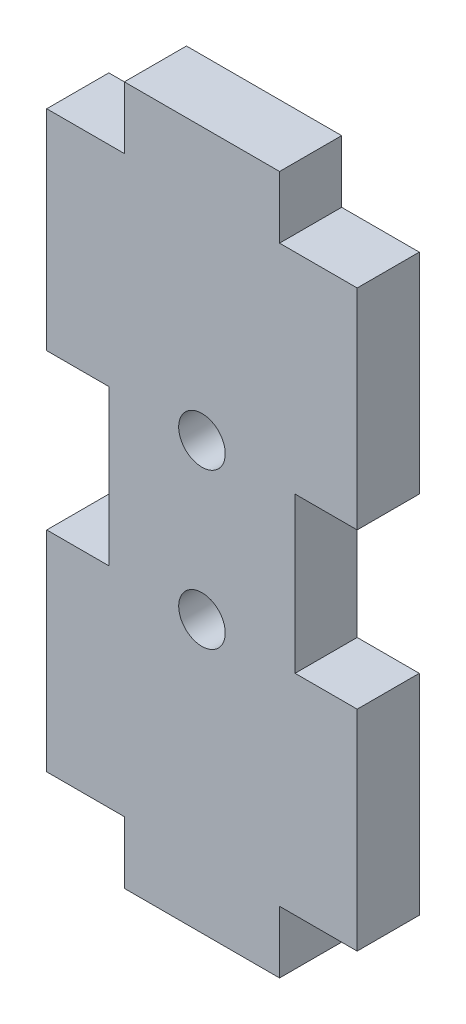
from build123d import *

# Parameters (mm, degrees)
SKETCH_1_R      = 1.5
EXTRUDE_1_DEPTH = 4


with BuildPart() as part:
    # Эскиз1 → Бобышка-Вытянуть1 (new body)
    with BuildSketch(Plane.XY):
        Polygon((0, 0), (5, 0), (5, -4), (15, -4), (15, 0), (20, 0), (20, 13.5), (16, 13.5), (16, 23.5), (20, 23.5), (20, 37), (15, 37), (15, 41), (5, 41), (5, 37), (0, 37), (0, 23.5), (4, 23.5), (4, 13.5), (0, 13.5), align=None)
        with Locations((10, 23.5)):
            Circle(SKETCH_1_R, mode=Mode.SUBTRACT)
        with Locations(Location((10, 13.5, 0), (0, 0, 180))):
            Circle(SKETCH_1_R, mode=Mode.SUBTRACT)
    extrude(amount=EXTRUDE_1_DEPTH)


solid = part.part
